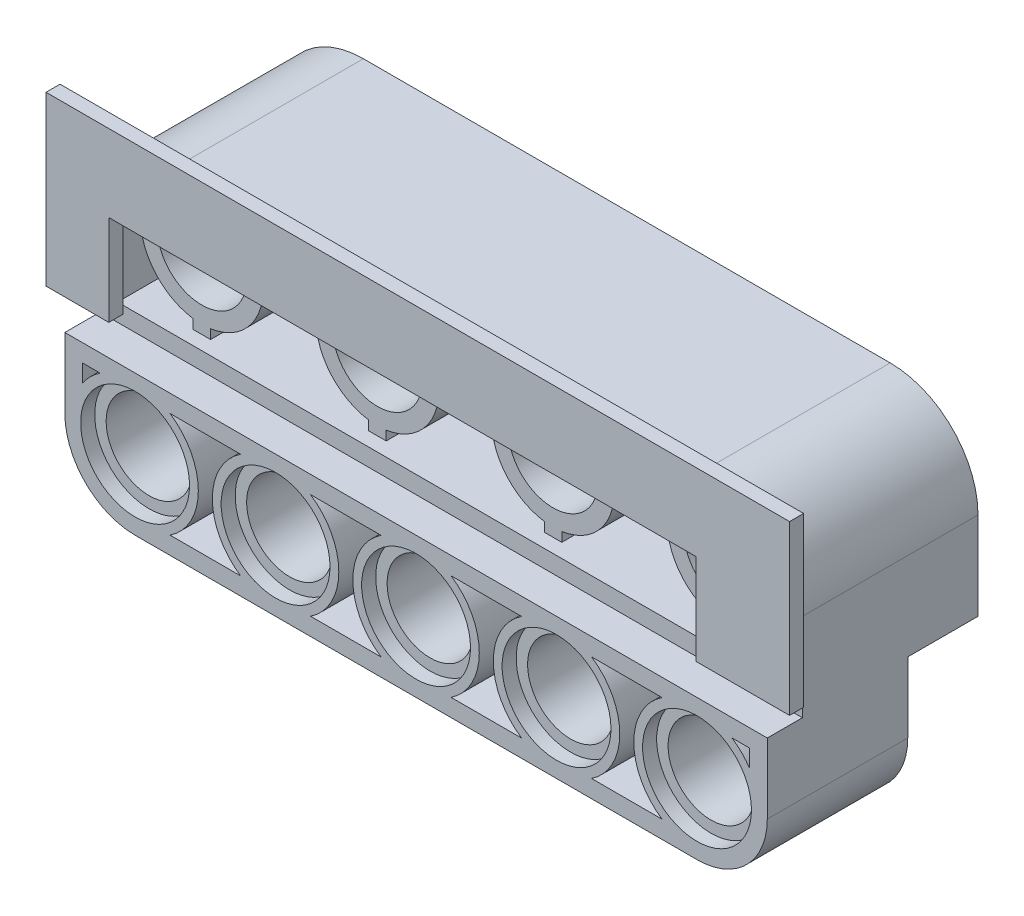
from build123d import *

# Parameters (mm, degrees)
SKETCH1_W                = 10
SKETCH1_H                = 10
SKETCH1_W_2              = 8
SKETCH1_H_2              = 8
BOSS_EXTRUDE1_DEPTH      = 40
SKETCH2_R                = 2.5
CUT_EXTRUDE1_DEPTH       = 44.231932642
SKETCH3_R                = 2.4
CUT_EXTRUDE2_DEPTH       = 43.813549257
FILLET1_R                = 5
FILLET2_R                = 4
SKETCH4_R                = 3.1
CUT_EXTRUDE3_DEPTH       = 0.8
CUT_EXTRUDE4_START       = -0.8
SKETCH5_R                = 3.1
CUT_EXTRUDE4_DEPTH       = 0.8
SKETCH6_R                = 3.5
CUT_EXTRUDE5_DEPTH       = 0.8
CUT_EXTRUDE6_START       = -0.8
SKETCH7_R                = 3.5
CUT_EXTRUDE6_DEPTH       = 0.8
SKETCH8_R                = 3.5
CUT_EXTRUDE7_DEPTH       = 4.5
CUT_EXTRUDE8_START       = -4.5
SKETCH9_R                = 3.5
CUT_EXTRUDE8_DEPTH       = 4.5
CUT_EXTRUDE9_DEPTH       = 3.5
CUT_EXTRUDE10_START      = -3.5
CUT_EXTRUDE10_DEPTH      = 3.5
BOSS_EXTRUDE2_DEPTH      = 3.7
BOSS_EXTRUDE3_START      = -3.7
BOSS_EXTRUDE3_DEPTH      = 3.7
CUT_EXTRUDE13_DEPTH      = 44.525165135
CUT_EXTRUDE13_DEPTH_BACK = 44.525165135
SKETCH16_R               = 2.55
SKETCH16_R_2             = 2.45
SKETCH17_R               = 0.5
BOSS_EXTRUDE4_DEPTH      = 2
BOSS_EXTRUDE5_START      = -0.8
SKETCH18_R               = 0.5
BOSS_EXTRUDE5_DEPTH      = 0.8


with BuildPart() as part:
    # Sketch1 → Boss-Extrude1 (new body)
    with BuildSketch(Plane(origin=(0, 0, 0), x_dir=(0, 0, -1), z_dir=(1, 0, 0))):
        Rectangle(SKETCH1_W, SKETCH1_H)
        with Locations((-1, -9)):
            Rectangle(SKETCH1_W_2, SKETCH1_H_2)
    extrude(amount=BOSS_EXTRUDE1_DEPTH)

    # Sketch2 → Cut-Extrude1 (cut, through all)
    with BuildSketch(Plane(origin=(0, 0, -5), x_dir=(-1, 0, 0), z_dir=(0, 0, -1))):
        with Locations(Location((-35, 0, 0), (0, 0, 90))):
            Circle(SKETCH2_R)
        with Locations(Location((-25, 0, 0), (0, 0, 90))):
            Circle(SKETCH2_R)
        with Locations(Location((-15, 0, 0), (0, 0, 90))):
            Circle(SKETCH2_R)
        with Locations(Location((-5, 0, 0), (0, 0, 90))):
            Circle(SKETCH2_R)
    extrude(amount=-CUT_EXTRUDE1_DEPTH, mode=Mode.SUBTRACT)

    # Sketch3 → Cut-Extrude2 (cut, through all)
    with BuildSketch(Plane(origin=(0, 0, -3), x_dir=(-1, 0, 0), z_dir=(0, 0, -1))):
        with Locations((-36, -9)):
            Circle(SKETCH3_R)
        with Locations((-28, -9)):
            Circle(SKETCH3_R)
        with Locations((-20, -9)):
            Circle(SKETCH3_R)
        with Locations((-12, -9)):
            Circle(SKETCH3_R)
        with Locations((-4, -9)):
            Circle(SKETCH3_R)
    extrude(amount=-CUT_EXTRUDE2_DEPTH, mode=Mode.SUBTRACT)

    # Fillet1
    fillet1_edges = [part.edges().sort_by_distance(p)[0] for p in [
        (0, 5, 0),
        (40, 5, 0),
    ]]
    fillet(fillet1_edges, radius=FILLET1_R)

    # Fillet2
    fillet2_edges = [part.edges().sort_by_distance(p)[0] for p in [
        (40, -13, 1),
        (0, -13, 1),
    ]]
    fillet(fillet2_edges, radius=FILLET2_R)

    # Sketch4 → Cut-Extrude3 (cut)
    with BuildSketch(Plane(origin=(0, 0, -3), x_dir=(-1, 0, 0), z_dir=(0, 0, -1))):
        with Locations((-36, -9)):
            Circle(SKETCH4_R)
        with Locations((-28, -9)):
            Circle(SKETCH4_R)
        with Locations((-20, -9)):
            Circle(SKETCH4_R)
        with Locations((-12, -9)):
            Circle(SKETCH4_R)
        with Locations((-4, -9)):
            Circle(SKETCH4_R)
    extrude(amount=-CUT_EXTRUDE3_DEPTH, mode=Mode.SUBTRACT)

    # Sketch5 → Cut-Extrude4 (cut)
    with BuildSketch(Plane.XY.offset(5).offset(CUT_EXTRUDE4_START)):
        with Locations(Location((4, -9, 0), (0, 0, 180))):
            Circle(SKETCH5_R)
        with Locations(Location((12, -9, 0), (0, 0, 180))):
            Circle(SKETCH5_R)
        with Locations(Location((20, -9, 0), (0, 0, 180))):
            Circle(SKETCH5_R)
        with Locations(Location((28, -9, 0), (0, 0, 180))):
            Circle(SKETCH5_R)
        with Locations(Location((36, -9, 0), (0, 0, 180))):
            Circle(SKETCH5_R)
    extrude(amount=CUT_EXTRUDE4_DEPTH, mode=Mode.SUBTRACT)

    # Sketch6 → Cut-Extrude5 (cut)
    with BuildSketch(Plane(origin=(0, 0, -5), x_dir=(-1, 0, 0), z_dir=(0, 0, -1))):
        with Locations(Location((-25, 0, 0), (0, 0, 90))):
            Circle(SKETCH6_R)
        with Locations(Location((-35, 0, 0), (0, 0, 90))):
            Circle(SKETCH6_R)
        with Locations(Location((-15, 0, 0), (0, 0, 90))):
            Circle(SKETCH6_R)
        with Locations(Location((-5, 0, 0), (0, 0, 90))):
            Circle(SKETCH6_R)
    extrude(amount=-CUT_EXTRUDE5_DEPTH, mode=Mode.SUBTRACT)

    # Sketch7 → Cut-Extrude6 (cut)
    with BuildSketch(Plane.XY.offset(5).offset(CUT_EXTRUDE6_START)):
        with Locations(Location((5, 0, 0), (0, 0, 90))):
            Circle(SKETCH7_R)
        with Locations(Location((15, 0, 0), (0, 0, 90))):
            Circle(SKETCH7_R)
        with Locations(Location((35, 0, 0), (0, 0, 90))):
            Circle(SKETCH7_R)
        with Locations(Location((25, 0, 0), (0, 0, 90))):
            Circle(SKETCH7_R)
    extrude(amount=CUT_EXTRUDE6_DEPTH, mode=Mode.SUBTRACT)

    # Sketch8 → Cut-Extrude7 (cut)
    with BuildSketch(Plane(origin=(0, 0, -5), x_dir=(-1, 0, 0), z_dir=(0, 0, -1))):
        with BuildLine():
            Line((-1, -4), (-1, 0))
            ThreePointArc((-1, 0), (-2.171572875, 2.828427125), (-5, 4))
            Line((-5, 4), (-35, 4))
            ThreePointArc((-35, 4), (-37.828427125, 2.828427125), (-39, 0))
            Line((-39, 0), (-39, -4))
            Line((-39, -4), (-1, -4))
        make_face()
        with Locations(Location((-5, 0, 0), (0, 0, 180))):
            Circle(SKETCH8_R, mode=Mode.SUBTRACT)
        with Locations(Location((-15, 0, 0), (0, 0, 180))):
            Circle(SKETCH8_R, mode=Mode.SUBTRACT)
        with Locations(Location((-25, 0, 0), (0, 0, 180))):
            Circle(SKETCH8_R, mode=Mode.SUBTRACT)
        with Locations(Location((-35, 0, 0), (0, 0, 180))):
            Circle(SKETCH8_R, mode=Mode.SUBTRACT)
    extrude(amount=-CUT_EXTRUDE7_DEPTH, mode=Mode.SUBTRACT)

    # Sketch9 → Cut-Extrude8 (cut)
    with BuildSketch(Plane.XY.offset(5).offset(CUT_EXTRUDE8_START)):
        with BuildLine():
            Line((35, 4), (5, 4))
            ThreePointArc((5, 4), (2.171572875, 2.828427125), (1, 0))
            Line((1, 0), (1, -4))
            Line((1, -4), (39, -4))
            Line((39, -4), (39, 0))
            ThreePointArc((39, 0), (37.828427125, 2.828427125), (35, 4))
        make_face()
        with Locations(Location((25, 0, 0), (0, 0, 90))):
            Circle(SKETCH9_R, mode=Mode.SUBTRACT)
        with Locations(Location((15, 0, 0), (0, 0, 90))):
            Circle(SKETCH9_R, mode=Mode.SUBTRACT)
        with Locations(Location((35, 0, 0), (0, 0, 90))):
            Circle(SKETCH9_R, mode=Mode.SUBTRACT)
        with Locations(Location((5, 0, 0), (0, 0, 90))):
            Circle(SKETCH9_R, mode=Mode.SUBTRACT)
    extrude(amount=CUT_EXTRUDE8_DEPTH, mode=Mode.SUBTRACT)

    # Sketch10 → Cut-Extrude9 (cut)
    with BuildSketch(Plane(origin=(0, 0, -3), x_dir=(-1, 0, 0), z_dir=(0, 0, -1))):
        with BuildLine():
            ThreePointArc((-32.4, -9), (-32.827941556, -10.702364599), (-34.010025126, -12))
            Line((-34.010025126, -12), (-29.989974874, -12))
            ThreePointArc((-29.989974874, -12), (-31.6, -9), (-29.989974874, -6))
            Line((-29.989974874, -6), (-34.010025126, -6))
            ThreePointArc((-34.010025126, -6), (-32.827941556, -7.297635401), (-32.4, -9))
        make_face()
        with BuildLine():
            ThreePointArc((-24.4, -9), (-24.827941556, -10.702364599), (-26.010025126, -12))
            Line((-26.010025126, -12), (-21.989974874, -12))
            ThreePointArc((-21.989974874, -12), (-23.6, -9), (-21.989974874, -6))
            Line((-21.989974874, -6), (-26.010025126, -6))
            ThreePointArc((-26.010025126, -6), (-24.827941556, -7.297635401), (-24.4, -9))
        make_face()
        with BuildLine():
            ThreePointArc((-16.4, -9), (-16.827941556, -10.702364599), (-18.010025126, -12))
            Line((-18.010025126, -12), (-13.989974874, -12))
            ThreePointArc((-13.989974874, -12), (-15.6, -9), (-13.989974874, -6))
            Line((-13.989974874, -6), (-18.010025126, -6))
            ThreePointArc((-18.010025126, -6), (-16.827941556, -7.297635401), (-16.4, -9))
        make_face()
        with BuildLine():
            ThreePointArc((-8.4, -9), (-8.827941556, -10.702364599), (-10.010025126, -12))
            Line((-10.010025126, -12), (-5.989974874, -12))
            ThreePointArc((-5.989974874, -12), (-7.6, -9), (-5.989974874, -6))
            Line((-5.989974874, -6), (-10.010025126, -6))
            ThreePointArc((-10.010025126, -6), (-8.827941556, -7.297635401), (-8.4, -9))
        make_face()
        with BuildLine():
            Line((-39, -6), (-39, -7.010025126))
            ThreePointArc((-39, -7.010025126), (-38.545584412, -6.454415588), (-37.989974874, -6))
            Line((-37.989974874, -6), (-39, -6))
        make_face()
        with BuildLine():
            Line((-1, -7.010025126), (-1, -6))
            Line((-1, -6), (-2.010025126, -6))
            ThreePointArc((-2.010025126, -6), (-1.454415588, -6.454415588), (-1, -7.010025126))
        make_face()
    extrude(amount=-CUT_EXTRUDE9_DEPTH, mode=Mode.SUBTRACT)

    # Sketch11 → Cut-Extrude10 (cut)
    with BuildSketch(Plane.XY.offset(5).offset(CUT_EXTRUDE10_START)):
        with BuildLine():
            Line((10.010025126, -6), (5.989974874, -6))
            ThreePointArc((5.989974874, -6), (7.172058444, -7.297635401), (7.6, -9))
            ThreePointArc((7.6, -9), (7.172058444, -10.702364599), (5.989974874, -12))
            Line((5.989974874, -12), (10.010025126, -12))
            ThreePointArc((10.010025126, -12), (8.4, -9), (10.010025126, -6))
        make_face()
        with BuildLine():
            Line((18.010025126, -6), (13.989974874, -6))
            ThreePointArc((13.989974874, -6), (15.172058444, -7.297635401), (15.6, -9))
            ThreePointArc((15.6, -9), (15.172058444, -10.702364599), (13.989974874, -12))
            Line((13.989974874, -12), (18.010025126, -12))
            ThreePointArc((18.010025126, -12), (16.4, -9), (18.010025126, -6))
        make_face()
        with BuildLine():
            ThreePointArc((26.010025126, -12), (24.4, -9), (26.010025126, -6))
            Line((26.010025126, -6), (21.989974874, -6))
            ThreePointArc((21.989974874, -6), (23.172058444, -7.297635401), (23.6, -9))
            ThreePointArc((23.6, -9), (23.172058444, -10.702364599), (21.989974874, -12))
            Line((21.989974874, -12), (26.010025126, -12))
        make_face()
        with BuildLine():
            ThreePointArc((34.010025126, -12), (32.4, -9), (34.010025126, -6))
            Line((34.010025126, -6), (29.989974874, -6))
            ThreePointArc((29.989974874, -6), (31.172058444, -7.297635401), (31.6, -9))
            ThreePointArc((31.6, -9), (31.172058444, -10.702364599), (29.989974874, -12))
            Line((29.989974874, -12), (34.010025126, -12))
        make_face()
        with BuildLine():
            Line((39, -7.010025126), (39, -6))
            Line((39, -6), (37.989974874, -6))
            ThreePointArc((37.989974874, -6), (38.545584412, -6.454415588), (39, -7.010025126))
        make_face()
        with BuildLine():
            Line((2.010025126, -6), (1, -6))
            Line((1, -6), (1, -7.010025126))
            ThreePointArc((1, -7.010025126), (1.454415588, -6.454415588), (2.010025126, -6))
        make_face()
    extrude(amount=CUT_EXTRUDE10_DEPTH, mode=Mode.SUBTRACT)

    # Sketch12 → Boss-Extrude2 (add)
    with BuildSketch(Plane(origin=(0, 0, -4.2), x_dir=(-1, 0, 0), z_dir=(0, 0, -1))):
        with BuildLine():
            ThreePointArc((-31.5, 0), (-31.508986132, -0.250643519), (-31.535898385, -0.5))
            Line((-31.535898385, -0.5), (-28.464101615, -0.5))
            ThreePointArc((-28.464101615, -0.5), (-28.5, 0), (-28.464101615, 0.5))
            Line((-28.464101615, 0.5), (-31.535898385, 0.5))
            ThreePointArc((-31.535898385, 0.5), (-31.508986132, 0.250643519), (-31.5, 0))
        make_face()
        with BuildLine():
            ThreePointArc((-21.5, 0), (-21.508986132, -0.250643519), (-21.535898385, -0.5))
            Line((-21.535898385, -0.5), (-18.464101615, -0.5))
            ThreePointArc((-18.464101615, -0.5), (-18.5, 0), (-18.464101615, 0.5))
            Line((-18.464101615, 0.5), (-21.535898385, 0.5))
            ThreePointArc((-21.535898385, 0.5), (-21.508986132, 0.250643519), (-21.5, 0))
        make_face()
        with BuildLine():
            Line((-24.5, 4), (-25.5, 4))
            Line((-25.5, 4), (-25.5, 3.464101615))
            ThreePointArc((-25.5, 3.464101615), (-25, 3.5), (-24.5, 3.464101615))
            Line((-24.5, 3.464101615), (-24.5, 4))
        make_face()
        with BuildLine():
            Line((-35.5, 3.968626967), (-35.5, 3.464101615))
            ThreePointArc((-35.5, 3.464101615), (-35, 3.5), (-34.5, 3.464101615))
            Line((-34.5, 3.464101615), (-34.5, 4))
            Line((-34.5, 4), (-35, 4))
            ThreePointArc((-35, 4), (-35.25049165, 3.992149037), (-35.5, 3.968626967))
        make_face()
        with BuildLine():
            Line((-39, 0), (-39, -0.5))
            Line((-39, -0.5), (-38.464101615, -0.5))
            ThreePointArc((-38.464101615, -0.5), (-38.5, 0), (-38.464101615, 0.5))
            Line((-38.464101615, 0.5), (-38.968626967, 0.5))
            ThreePointArc((-38.968626967, 0.5), (-38.992149037, 0.25049165), (-39, 0))
        make_face()
        with BuildLine():
            Line((-25.5, -3.464101615), (-25.5, -4))
            Line((-25.5, -4), (-24.5, -4))
            Line((-24.5, -4), (-24.5, -3.464101615))
            ThreePointArc((-24.5, -3.464101615), (-25, -3.5), (-25.5, -3.464101615))
        make_face()
        with BuildLine():
            ThreePointArc((-34.5, -3.464101615), (-35, -3.5), (-35.5, -3.464101615))
            Line((-35.5, -3.464101615), (-35.5, -4))
            Line((-35.5, -4), (-34.5, -4))
            Line((-34.5, -4), (-34.5, -3.464101615))
        make_face()
        with BuildLine():
            Line((-15.5, -3.464101615), (-15.5, -4))
            Line((-15.5, -4), (-14.5, -4))
            Line((-14.5, -4), (-14.5, -3.464101615))
            ThreePointArc((-14.5, -3.464101615), (-15, -3.5), (-15.5, -3.464101615))
        make_face()
        with BuildLine():
            Line((-14.5, 4), (-15.5, 4))
            Line((-15.5, 4), (-15.5, 3.464101615))
            ThreePointArc((-15.5, 3.464101615), (-15, 3.5), (-14.5, 3.464101615))
            Line((-14.5, 3.464101615), (-14.5, 4))
        make_face()
        with BuildLine():
            ThreePointArc((-11.5, 0), (-11.508986132, -0.250643519), (-11.535898385, -0.5))
            Line((-11.535898385, -0.5), (-8.464101615, -0.5))
            ThreePointArc((-8.464101615, -0.5), (-8.5, 0), (-8.464101615, 0.5))
            Line((-8.464101615, 0.5), (-11.535898385, 0.5))
            ThreePointArc((-11.535898385, 0.5), (-11.508986132, 0.250643519), (-11.5, 0))
        make_face()
        with BuildLine():
            Line((-5, 4), (-5.5, 4))
            Line((-5.5, 4), (-5.5, 3.464101615))
            ThreePointArc((-5.5, 3.464101615), (-5, 3.5), (-4.5, 3.464101615))
            Line((-4.5, 3.464101615), (-4.5, 3.968626967))
            ThreePointArc((-4.5, 3.968626967), (-4.74950835, 3.992149037), (-5, 4))
        make_face()
        with BuildLine():
            Line((-5.5, -3.464101615), (-5.5, -4))
            Line((-5.5, -4), (-4.5, -4))
            Line((-4.5, -4), (-4.5, -3.464101615))
            ThreePointArc((-4.5, -3.464101615), (-5, -3.5), (-5.5, -3.464101615))
        make_face()
        with BuildLine():
            Line((-1.535898385, -0.5), (-1, -0.5))
            Line((-1, -0.5), (-1, 0))
            ThreePointArc((-1, 0), (-1.007850963, 0.25049165), (-1.031373033, 0.5))
            Line((-1.031373033, 0.5), (-1.535898385, 0.5))
            ThreePointArc((-1.535898385, 0.5), (-1.508986132, 0.250643519), (-1.5, 0))
            ThreePointArc((-1.5, 0), (-1.508986132, -0.250643519), (-1.535898385, -0.5))
        make_face()
    extrude(amount=-BOSS_EXTRUDE2_DEPTH)

    # Sketch13 → Boss-Extrude3 (add)
    with BuildSketch(Plane.XY.offset(4.2).offset(BOSS_EXTRUDE3_START)):
        with BuildLine():
            Line((15.5, 3.464101615), (15.5, 4))
            Line((15.5, 4), (14.5, 4))
            Line((14.5, 4), (14.5, 3.464101615))
            ThreePointArc((14.5, 3.464101615), (15, 3.5), (15.5, 3.464101615))
        make_face()
        with BuildLine():
            Line((5.5, 3.464101615), (5.5, 4))
            Line((5.5, 4), (5, 4))
            ThreePointArc((5, 4), (4.74950835, 3.992149037), (4.5, 3.968626967))
            Line((4.5, 3.968626967), (4.5, 3.464101615))
            ThreePointArc((4.5, 3.464101615), (5, 3.5), (5.5, 3.464101615))
        make_face()
        with BuildLine():
            Line((1, 0), (1, -0.5))
            Line((1, -0.5), (1.535898385, -0.5))
            ThreePointArc((1.535898385, -0.5), (1.5, 0), (1.535898385, 0.5))
            Line((1.535898385, 0.5), (1.031373033, 0.5))
            ThreePointArc((1.031373033, 0.5), (1.007850963, 0.25049165), (1, 0))
        make_face()
        with BuildLine():
            Line((4.5, -4), (5.5, -4))
            Line((5.5, -4), (5.5, -3.464101615))
            ThreePointArc((5.5, -3.464101615), (5, -3.5), (4.5, -3.464101615))
            Line((4.5, -3.464101615), (4.5, -4))
        make_face()
        with BuildLine():
            Line((8.464101615, -0.5), (11.535898385, -0.5))
            ThreePointArc((11.535898385, -0.5), (11.5, 0), (11.535898385, 0.5))
            Line((11.535898385, 0.5), (8.464101615, 0.5))
            ThreePointArc((8.464101615, 0.5), (8.491013868, 0.250643519), (8.5, 0))
            ThreePointArc((8.5, 0), (8.491013868, -0.250643519), (8.464101615, -0.5))
        make_face()
        with BuildLine():
            Line((14.5, -4), (15.5, -4))
            Line((15.5, -4), (15.5, -3.464101615))
            ThreePointArc((15.5, -3.464101615), (15, -3.5), (14.5, -3.464101615))
            Line((14.5, -3.464101615), (14.5, -4))
        make_face()
        with BuildLine():
            Line((18.464101615, -0.5), (21.535898385, -0.5))
            ThreePointArc((21.535898385, -0.5), (21.5, 0), (21.535898385, 0.5))
            Line((21.535898385, 0.5), (18.464101615, 0.5))
            ThreePointArc((18.464101615, 0.5), (18.491013868, 0.250643519), (18.5, 0))
            ThreePointArc((18.5, 0), (18.491013868, -0.250643519), (18.464101615, -0.5))
        make_face()
        with BuildLine():
            Line((25.5, 3.464101615), (25.5, 4))
            Line((25.5, 4), (24.5, 4))
            Line((24.5, 4), (24.5, 3.464101615))
            ThreePointArc((24.5, 3.464101615), (25, 3.5), (25.5, 3.464101615))
        make_face()
        with BuildLine():
            Line((28.464101615, -0.5), (31.535898385, -0.5))
            ThreePointArc((31.535898385, -0.5), (31.5, 0), (31.535898385, 0.5))
            Line((31.535898385, 0.5), (28.464101615, 0.5))
            ThreePointArc((28.464101615, 0.5), (28.491013868, 0.250643519), (28.5, 0))
            ThreePointArc((28.5, 0), (28.491013868, -0.250643519), (28.464101615, -0.5))
        make_face()
        with BuildLine():
            Line((24.5, -4), (25.5, -4))
            Line((25.5, -4), (25.5, -3.464101615))
            ThreePointArc((25.5, -3.464101615), (25, -3.5), (24.5, -3.464101615))
            Line((24.5, -3.464101615), (24.5, -4))
        make_face()
        with BuildLine():
            Line((35.5, 3.464101615), (35.5, 3.968626967))
            ThreePointArc((35.5, 3.968626967), (35.25049165, 3.992149037), (35, 4))
            Line((35, 4), (34.5, 4))
            Line((34.5, 4), (34.5, 3.464101615))
            ThreePointArc((34.5, 3.464101615), (35, 3.5), (35.5, 3.464101615))
        make_face()
        with BuildLine():
            Line((38.464101615, -0.5), (39, -0.5))
            Line((39, -0.5), (39, 0))
            ThreePointArc((39, 0), (38.992149037, 0.25049165), (38.968626967, 0.5))
            Line((38.968626967, 0.5), (38.464101615, 0.5))
            ThreePointArc((38.464101615, 0.5), (38.491013868, 0.250643519), (38.5, 0))
            ThreePointArc((38.5, 0), (38.491013868, -0.250643519), (38.464101615, -0.5))
        make_face()
        with BuildLine():
            Line((34.5, -4), (35.5, -4))
            Line((35.5, -4), (35.5, -3.464101615))
            ThreePointArc((35.5, -3.464101615), (35, -3.5), (34.5, -3.464101615))
            Line((34.5, -3.464101615), (34.5, -4))
        make_face()
    extrude(amount=BOSS_EXTRUDE3_DEPTH)


with BuildPart() as body_2:
    # Split1: the piece on the far side of the plane
    add(part.part)
    split(bisect_by=Plane(origin=(0, -5, 0), x_dir=(0, 0, -1), z_dir=(0, -1, 0)), keep=Keep.BOTTOM)


with BuildPart() as part_1:
    add(part.part)

    # Split1
    split(bisect_by=Plane(origin=(0, -5, 0), x_dir=(0, 0, -1), z_dir=(0, -1, 0)), keep=Keep.TOP)


with BuildPart() as body_2_1:
    # Body-Move/Copy1: moved
    add(body_2.part.moved(Location((0, 0, -2))))


with BuildPart() as part_2:
    add(part_1.part)

    # Combine1: union body 2
    add(body_2_1.part)

    # Sketch16 → Cut-Extrude13 (cut, two sides: drawn at the far end of the back side and taken through both)
    with BuildSketch(Plane(origin=(0, 0, -6.2), x_dir=(-1, 0, 0), z_dir=(0, 0, -1)).offset(-CUT_EXTRUDE13_DEPTH_BACK)):
        with Locations(Location((-35, 0, 0), (0, 0, 90))):
            Circle(SKETCH16_R)
        with Locations(Location((-25, 0, 0), (0, 0, 90))):
            Circle(SKETCH16_R)
        with Locations(Location((-15, 0, 0), (0, 0, 90))):
            Circle(SKETCH16_R)
        with Locations(Location((-5, 0, 0), (0, 0, 90))):
            Circle(SKETCH16_R)
        with Locations((-36, -9)):
            Circle(SKETCH16_R_2)
        with Locations((-28, -9)):
            Circle(SKETCH16_R_2)
        with Locations((-20, -9)):
            Circle(SKETCH16_R_2)
        with Locations((-12, -9)):
            Circle(SKETCH16_R_2)
        with Locations((-4, -9)):
            Circle(SKETCH16_R_2)
    extrude(amount=CUT_EXTRUDE13_DEPTH + CUT_EXTRUDE13_DEPTH_BACK, mode=Mode.SUBTRACT)

    # Sketch17 → Boss-Extrude4 (add)
    with BuildSketch(Plane.XY.offset(3)):
        with Locations(Location((1.88943361, 3.251826677, 0), (0, 0, 180))):
            Circle(SKETCH17_R)
        with Locations(Location((9.79386174, 4.5, 0), (0, 0, 180))):
            Circle(SKETCH17_R)
        with Locations(Location((0.5, -2.267034924, 0), (0, 0, 180))):
            Circle(SKETCH17_R)
        with Locations(Location((19.844202366, 4.5, 0), (0, 0, 180))):
            Circle(SKETCH17_R)
        with Locations(Location((29.894542992, 4.5, 0), (0, 0, 180))):
            Circle(SKETCH17_R)
        with Locations(Location((37.827720123, 3.500571226, 0), (0, 0, 180))):
            Circle(SKETCH17_R)
        with Locations(Location((39.5, -2.090409603, 0), (0, 0, 180))):
            Circle(SKETCH17_R)
    extrude(amount=BOSS_EXTRUDE4_DEPTH)

    # Sketch18 → Boss-Extrude5 (add)
    with BuildSketch(Plane.XY.offset(5).offset(BOSS_EXTRUDE5_START)):
        Polygon((41.268678944, 6.309130314), (-1.073553449, 6.309130314), (-1.073553449, -3.252018936), (2.503747291, -3.252018936), (2.503747291, 1.918806679), (35.93524875, 1.918806679), (35.93524875, -3.252018936), (41.268678944, -3.252018936), align=None)
        with Locations((0.5, -2.267034924)):
            Circle(SKETCH18_R, mode=Mode.SUBTRACT)
    extrude(amount=BOSS_EXTRUDE5_DEPTH)


solid = part_2.part
